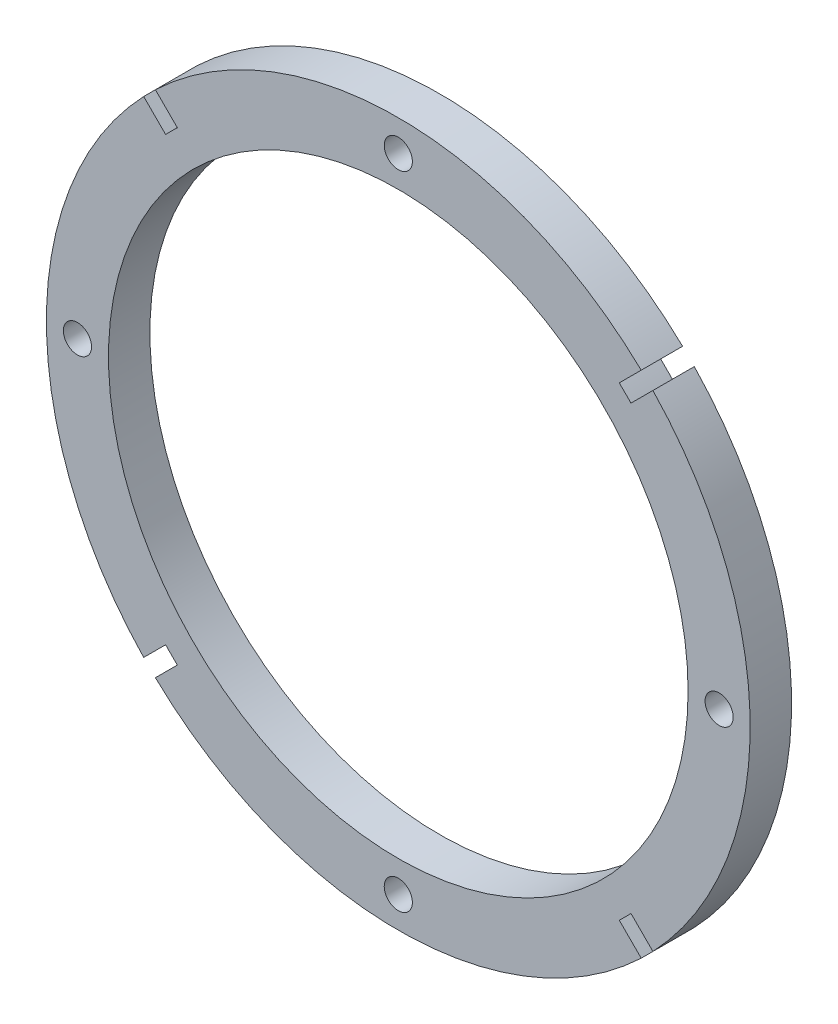
from build123d import *

# Parameters (mm, degrees)
SZKIC1_R                    = 85
SZKIC1_R_2                  = 70
DODANIE_WYCI_GNI_CIE1_DEPTH = 10
WYTNIJ_WYCI_GNI_CIE1_START  = -10
SZKIC2_R                    = 3.4
WYTNIJ_WYCI_GNI_CIE1_DEPTH  = 10
SZYK_KO_OWY1_COUNT          = 4


with BuildPart() as part:
    # Szkic1 → Dodanie-wyciągnięcie1 (new body)
    with BuildSketch(Plane.XY):
        Circle(SZKIC1_R)
        Circle(SZKIC1_R_2, mode=Mode.SUBTRACT)
    extrude(amount=DODANIE_WYCI_GNI_CIE1_DEPTH)

    # Szkic2 → Wytnij-wyciągnięcie1 (cut)
    with BuildSketch(Plane.XY.offset(10).offset(WYTNIJ_WYCI_GNI_CIE1_START)):
        with Locations((0, 77.5)):
            Circle(SZKIC2_R)
        with BuildLine():
            Line((-56.196738148, 53.368311023), (-61.501649853, 58.673222728))
            ThreePointArc((-61.501649853, 58.673222728), (-60.104076401, 60.104076401), (-58.673222728, 61.501649853))
            Line((-58.673222728, 61.501649853), (-53.368311023, 56.196738148))
            ThreePointArc((-53.368311023, 56.196738148), (-54.800775542, 54.800775542), (-56.196738148, 53.368311023))
        make_face()
    wytnij_wyci_gni_cie1 = extrude(amount=WYTNIJ_WYCI_GNI_CIE1_DEPTH, mode=Mode.SUBTRACT)

    # Szyk kołowy1: Wytnij-wyciągnięcie1 ×4 about axis
    szyk_ko_owy1_axis = Axis((0, 0, 0), (0, 0, 1))
    for i in range(1, SZYK_KO_OWY1_COUNT):
        add(wytnij_wyci_gni_cie1.rotate(szyk_ko_owy1_axis, i * 360 / SZYK_KO_OWY1_COUNT), mode=Mode.SUBTRACT)


solid = part.part
